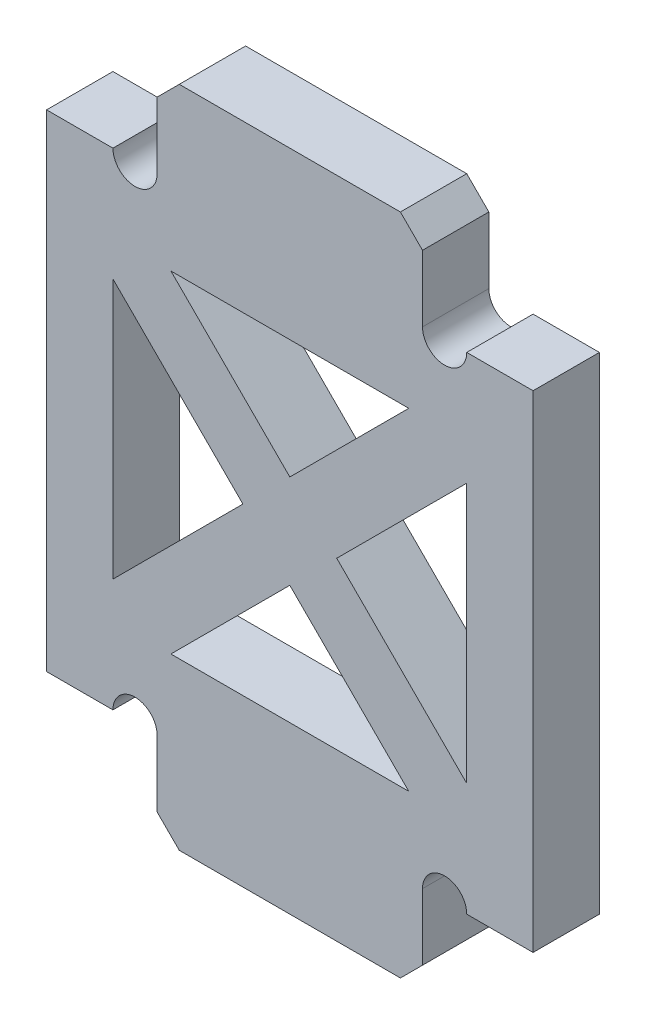
from build123d import *

# Parameters (mm, degrees)
EXTRUDE_1_DEPTH = 1.5
CHAMFER_1_SIZE  = 1


with BuildPart() as part:
    # 草图1 → 凸台-拉伸1 (new, symmetric)
    with BuildSketch(Plane.XY):
        with BuildLine():
            Line((-6, 15), (-6, 11))
            ThreePointArc((-6, 11), (-7, 10), (-8, 11))
            Line((-8, 11), (-11, 11))
            Line((-11, 11), (-11, -11))
            Line((-11, -11), (-8, -11))
            ThreePointArc((-8, -11), (-7, -10), (-6, -11))
            Line((-6, -11), (-6, -15))
            Line((-6, -15), (6, -15))
            Line((6, -15), (6, -11))
            ThreePointArc((6, -11), (7, -10), (8, -11))
            Line((8, -11), (11, -11))
            Line((11, -11), (11, 11))
            Line((11, 11), (8, 11))
            ThreePointArc((8, 11), (7, 10), (6, 11))
            Line((6, 11), (6, 15))
            Line((6, 15), (-6, 15))
        make_face()
        Polygon((5.378679656, 7.5), (0, 2.121320344), (-5.378679656, 7.5), align=None, mode=Mode.SUBTRACT)
        Polygon((0, -2.121320344), (5.378679656, -7.5), (-5.378679656, -7.5), align=None, mode=Mode.SUBTRACT)
        Polygon((-8, 5.878679656), (-2.121320344, 0), (-8, -5.878679656), align=None, mode=Mode.SUBTRACT)
        Polygon((8, -5.878679656), (2.121320344, 0), (8, 5.878679656), align=None, mode=Mode.SUBTRACT)
    extrude(amount=EXTRUDE_1_DEPTH, both=True)

    # 倒角1
    chamfer_1_edges = [part.edges().sort_by_distance(p)[0] for p in [
        (-6, 15, 0),
        (6, 15, 0),
        (6, -15, 0),
        (-6, -15, 0),
    ]]
    chamfer(chamfer_1_edges, length=CHAMFER_1_SIZE)


solid = part.part
